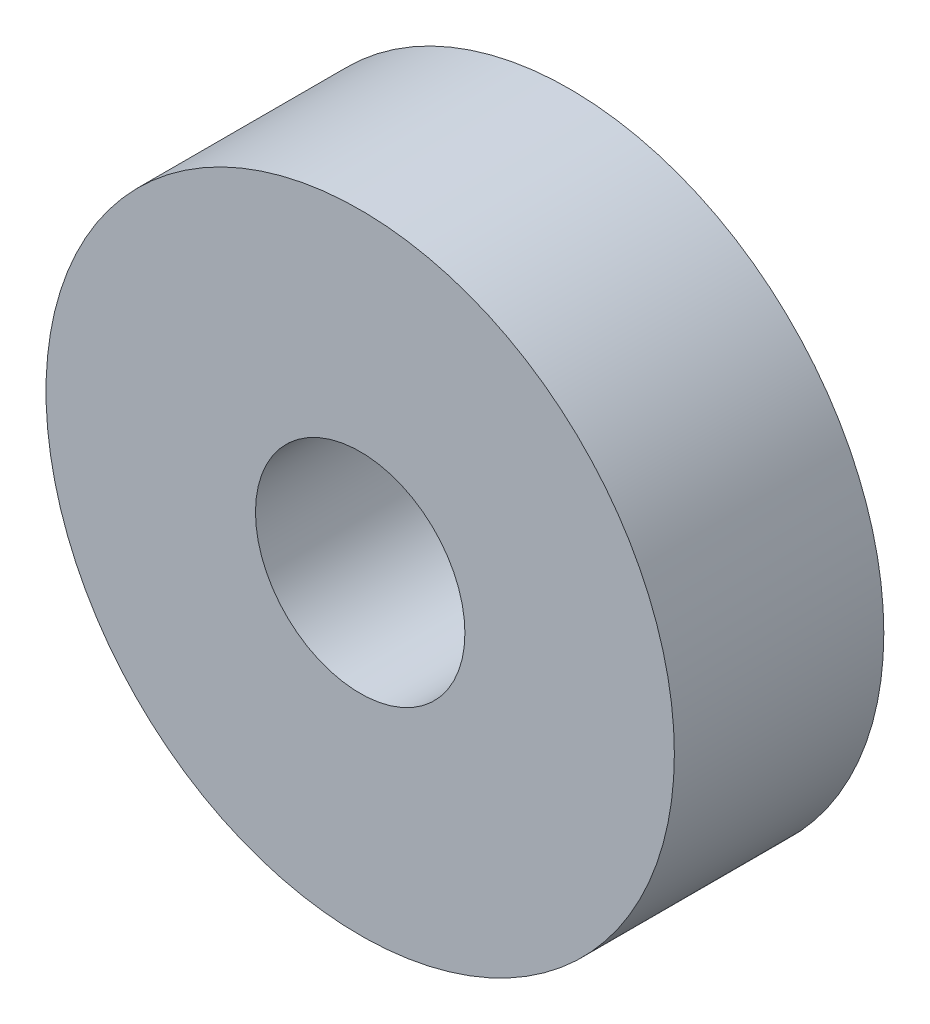
from build123d import *

# Parameters (mm, degrees)
SKETCH_1_R      = 12
SKETCH_1_R_2    = 4
EXTRUDE_1_DEPTH = 8


with BuildPart() as part:
    # 草图1 → 拉伸1 (new body)
    with BuildSketch(Plane.XY):
        Circle(SKETCH_1_R)
        Circle(SKETCH_1_R_2, mode=Mode.SUBTRACT)
    extrude(amount=EXTRUDE_1_DEPTH)


solid = part.part
